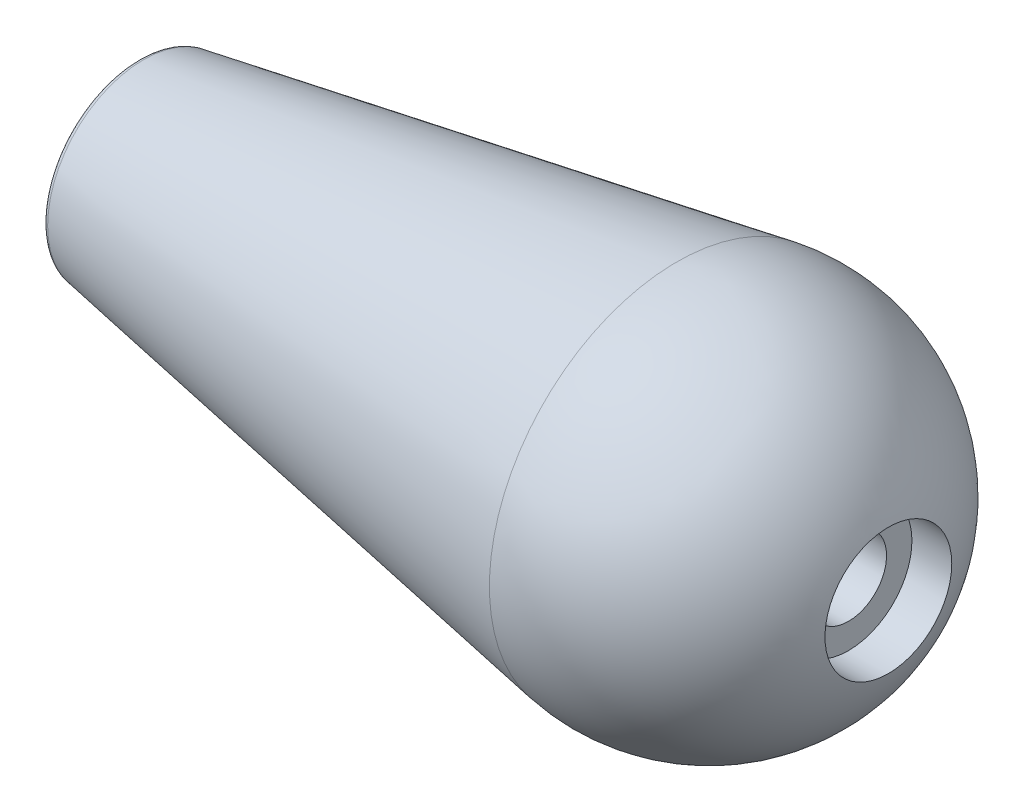
from build123d import *

# Parameters (mm, degrees)
FILLET1_R = 1


with BuildPart() as part:
    # Sketch1 → Revolve1 (revolve)
    with BuildSketch(Plane(origin=(0, 0, 0), x_dir=(1, 0, 0), z_dir=(0, 1, 0))):
        with BuildLine():
            Line((0, 0), (120, 0))
            ThreePointArc((120, 0), (109.337020363, 22.936426127), (84.928023767, 29.568142605))
            Line((84.928023767, 29.568142605), (0, 15))
            Line((0, 15), (0, 0))
        make_face()
    revolve(axis=Axis((0, 0, 0), (1, 0, 0)))

    # Sketch2 → Cut-Revolve2 (revolve, cut)
    with BuildSketch(Plane.XY, mode=Mode.PRIVATE) as cut_revolve2_sk:
        Polygon((0, 0), (120, 0), (120, 10), (112, 10), (112, 6), (8, 6), (8, 10), (0, 10), align=None)
    revolve(cut_revolve2_sk.sketch.rotate(Axis((0, 0, 0), (1, 0, 0)), 180), axis=Axis((0, 0, 0), (1, 0, 0)), mode=Mode.SUBTRACT)

    # Fillet1
    fillet1_edges = [part.edges().sort_by_distance(p)[0] for p in [
        (0, 0, 15),
    ]]
    fillet(fillet1_edges, radius=FILLET1_R)


solid = part.part
